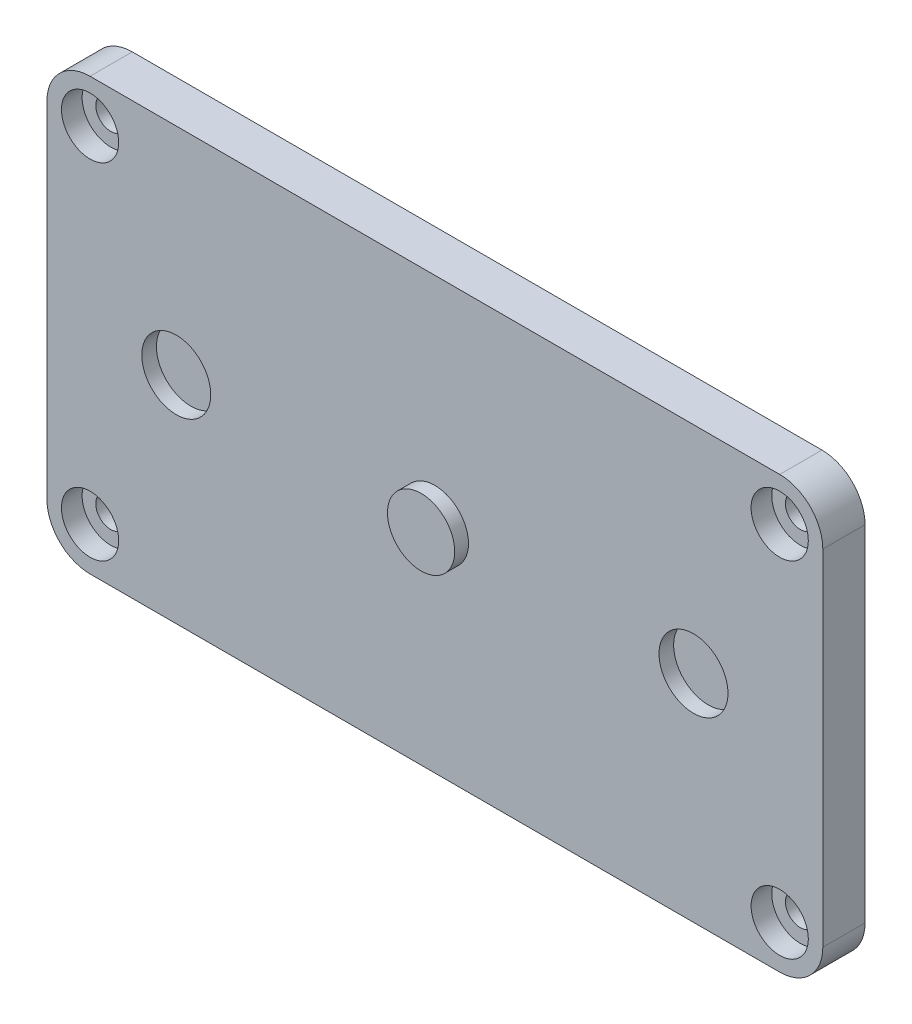
from build123d import *

# Parameters (mm, degrees)
SKETCH1_R           = 2.2098
BOSS_EXTRUDE1_DEPTH = 6.223
SKETCH2_R           = 4.2164
CUT_EXTRUDE1_DEPTH  = 3.048
SKETCH3_R           = 5.08
CUT_EXTRUDE2_DEPTH  = 2.159
SKETCH4_R           = 4.953
BOSS_EXTRUDE2_DEPTH = 2.032


with BuildPart() as part:
    # Sketch1 → Boss-Extrude1 (new body)
    with BuildSketch(Plane.XY):
        with BuildLine():
            Line((-50.8, -31.75), (50.8, -31.75))
            ThreePointArc((50.8, -31.75), (55.290128061, -29.890128061), (57.15, -25.4))
            Line((57.15, -25.4), (57.15, 25.4))
            ThreePointArc((57.15, 25.4), (55.290128061, 29.890128061), (50.8, 31.75))
            Line((50.8, 31.75), (-50.8, 31.75))
            ThreePointArc((-50.8, 31.75), (-55.290128061, 29.890128061), (-57.15, 25.4))
            Line((-57.15, 25.4), (-57.15, -25.4))
            ThreePointArc((-57.15, -25.4), (-55.290128061, -29.890128061), (-50.8, -31.75))
        make_face()
        with Locations((-50.8, -25.4)):
            Circle(SKETCH1_R, mode=Mode.SUBTRACT)
        with Locations((-50.8, 25.4)):
            Circle(SKETCH1_R, mode=Mode.SUBTRACT)
        with Locations((50.8, 25.4)):
            Circle(SKETCH1_R, mode=Mode.SUBTRACT)
        with Locations((50.8, -25.4)):
            Circle(SKETCH1_R, mode=Mode.SUBTRACT)
    extrude(amount=BOSS_EXTRUDE1_DEPTH)

    # Sketch2 → Cut-Extrude1 (cut)
    with BuildSketch(Plane.XY.offset(6.223)):
        with Locations((-50.8, 25.4)):
            Circle(SKETCH2_R)
        with Locations((50.8, 25.4)):
            Circle(SKETCH2_R)
        with Locations((50.8, -25.4)):
            Circle(SKETCH2_R)
        with Locations((-50.8, -25.4)):
            Circle(SKETCH2_R)
    extrude(amount=-CUT_EXTRUDE1_DEPTH, mode=Mode.SUBTRACT)

    # Sketch3 → Cut-Extrude2 (cut)
    with BuildSketch(Plane.XY.offset(6.223)):
        with Locations((38.1, 0)):
            Circle(SKETCH3_R)
        with Locations((-38.1, 0)):
            Circle(SKETCH3_R)
    extrude(amount=-CUT_EXTRUDE2_DEPTH, mode=Mode.SUBTRACT)

    # Sketch4 → Boss-Extrude2 (add)
    with BuildSketch(Plane.XY.offset(6.223)):
        Circle(SKETCH4_R)
    extrude(amount=BOSS_EXTRUDE2_DEPTH)


solid = part.part
